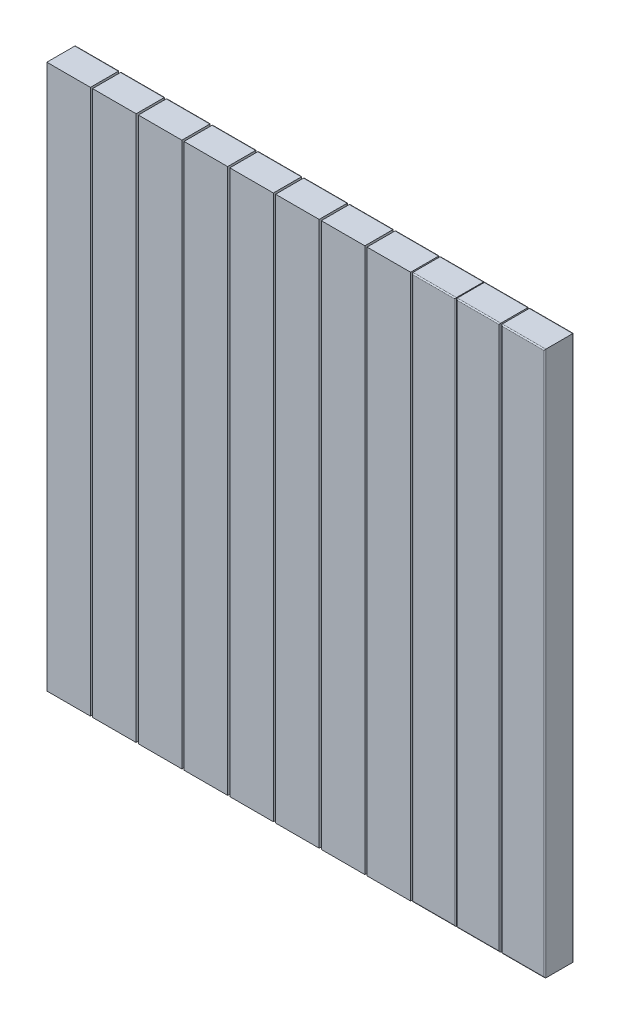
from build123d import *

# Parameters (mm, degrees)
SKETCH1_W              = 200
SKETCH1_H              = 2500
BOSS_EXTRUDE1_DEPTH    = 133
BOSS_EXTRUDE1_2_DEPTH  = 133
BOSS_EXTRUDE1_3_DEPTH  = 133
BOSS_EXTRUDE1_4_DEPTH  = 133
BOSS_EXTRUDE1_5_DEPTH  = 133
BOSS_EXTRUDE1_6_DEPTH  = 133
BOSS_EXTRUDE1_7_DEPTH  = 133
BOSS_EXTRUDE1_8_DEPTH  = 133
BOSS_EXTRUDE1_9_DEPTH  = 133
BOSS_EXTRUDE1_10_DEPTH = 133
BOSS_EXTRUDE1_11_DEPTH = 133
FILLET1_R              = 5
FILLET2_R              = 5
FILLET3_R              = 5
FILLET4_R              = 5
FILLET5_R              = 5
FILLET6_R              = 5
FILLET7_R              = 5
FILLET8_R              = 5
FILLET9_R              = 5
FILLET10_R             = 5
FILLET11_R             = 5
FILLET12_R             = 5
FILLET13_R             = 5
FILLET14_R             = 5


with BuildPart() as part:
    # Sketch1 → Boss-Extrude1 (new body)
    with BuildSketch(Plane.XY):
        with Locations((310, 1250)):
            Rectangle(SKETCH1_W, SKETCH1_H)
    extrude(amount=BOSS_EXTRUDE1_DEPTH)

    # Fillet8
    fillet8_edges = [part.edges().sort_by_distance(p)[0] for p in [
        (210, 1250, 0),
        (310, 2500, 0),
        (410, 1250, 0),
        (310, 0, 0),
    ]]
    fillet(fillet8_edges, radius=FILLET8_R)


with BuildPart() as body_2:
    # Sketch1 → Boss-Extrude1 2 (new body)
    with BuildSketch(Plane.XY):
        with Locations((100, 1250)):
            Rectangle(SKETCH1_W, SKETCH1_H)
    extrude(amount=BOSS_EXTRUDE1_2_DEPTH)

    # Fillet1
    fillet1_edges = [body_2.edges().sort_by_distance(p)[0] for p in [
        (100, 2500, 0),
        (200, 1250, 0),
        (100, 0, 0),
        (0, 1250, 0),
    ]]
    fillet(fillet1_edges, radius=FILLET1_R)


with BuildPart() as body_3:
    # Sketch1 → Boss-Extrude1 3 (new body)
    with BuildSketch(Plane.XY):
        with Locations((520, 1250)):
            Rectangle(SKETCH1_W, SKETCH1_H)
    extrude(amount=BOSS_EXTRUDE1_3_DEPTH)

    # Fillet7
    fillet7_edges = [body_3.edges().sort_by_distance(p)[0] for p in [
        (420, 1250, 0),
        (520, 2500, 0),
        (620, 1250, 0),
        (520, 0, 0),
    ]]
    fillet(fillet7_edges, radius=FILLET7_R)


with BuildPart() as body_4:
    # Sketch1 → Boss-Extrude1 4 (new body)
    with BuildSketch(Plane.XY):
        with Locations((730, 1250)):
            Rectangle(SKETCH1_W, SKETCH1_H)
    extrude(amount=BOSS_EXTRUDE1_4_DEPTH)

    # Fillet6
    fillet6_edges = [body_4.edges().sort_by_distance(p)[0] for p in [
        (630, 1250, 0),
        (730, 2500, 0),
        (830, 1250, 0),
        (730, 0, 0),
    ]]
    fillet(fillet6_edges, radius=FILLET6_R)


with BuildPart() as body_5:
    # Sketch1 → Boss-Extrude1 5 (new body)
    with BuildSketch(Plane.XY):
        with Locations((940, 1250)):
            Rectangle(SKETCH1_W, SKETCH1_H)
    extrude(amount=BOSS_EXTRUDE1_5_DEPTH)

    # Fillet5
    fillet5_edges = [body_5.edges().sort_by_distance(p)[0] for p in [
        (840, 1250, 0),
        (940, 2500, 0),
        (1040, 1250, 0),
        (940, 0, 0),
    ]]
    fillet(fillet5_edges, radius=FILLET5_R)


with BuildPart() as body_6:
    # Sketch1 → Boss-Extrude1 6 (new body)
    with BuildSketch(Plane.XY):
        with Locations((1150, 1250)):
            Rectangle(SKETCH1_W, SKETCH1_H)
    extrude(amount=BOSS_EXTRUDE1_6_DEPTH)

    # Fillet4
    fillet4_edges = [body_6.edges().sort_by_distance(p)[0] for p in [
        (1050, 1250, 0),
        (1150, 2500, 0),
        (1250, 1250, 0),
        (1150, 0, 0),
    ]]
    fillet(fillet4_edges, radius=FILLET4_R)


with BuildPart() as body_7:
    # Sketch1 → Boss-Extrude1 7 (new body)
    with BuildSketch(Plane.XY):
        with Locations((1360, 1250)):
            Rectangle(SKETCH1_W, SKETCH1_H)
    extrude(amount=BOSS_EXTRUDE1_7_DEPTH)

    # Fillet3
    fillet3_edges = [body_7.edges().sort_by_distance(p)[0] for p in [
        (1260, 1250, 0),
        (1360, 2500, 0),
        (1460, 1250, 0),
        (1360, 0, 0),
    ]]
    fillet(fillet3_edges, radius=FILLET3_R)


with BuildPart() as body_8:
    # Sketch1 → Boss-Extrude1 8 (new body)
    with BuildSketch(Plane.XY):
        with Locations((1570, 1250)):
            Rectangle(SKETCH1_W, SKETCH1_H)
    extrude(amount=BOSS_EXTRUDE1_8_DEPTH)

    # Fillet2
    fillet2_edges = [body_8.edges().sort_by_distance(p)[0] for p in [
        (1470, 1250, 0),
        (1570, 2500, 0),
        (1670, 1250, 0),
        (1570, 0, 0),
    ]]
    fillet(fillet2_edges, radius=FILLET2_R)


with BuildPart() as body_9:
    # Sketch1 → Boss-Extrude1 9 (new body)
    with BuildSketch(Plane.XY):
        with Locations((1775.997192349, 1250)):
            Rectangle(SKETCH1_W, SKETCH1_H)
    extrude(amount=BOSS_EXTRUDE1_9_DEPTH)

    # Fillet9
    fillet9_edges = [body_9.edges().sort_by_distance(p)[0] for p in [
        (1775.997192349, 2500, 133),
        (1675.997192349, 1250, 133),
        (1775.997192349, 0, 133),
        (1875.997192349, 1250, 133),
    ]]
    fillet(fillet9_edges, radius=FILLET9_R)

    # Fillet13
    fillet13_edges = [body_9.edges().sort_by_distance(p)[0] for p in [
        (1675.997192349, 1250, 0),
        (1775.997192349, 2500, 0),
        (1875.997192349, 1250, 0),
        (1775.997192349, 0, 0),
    ]]
    fillet(fillet13_edges, radius=FILLET13_R)


with BuildPart() as body_10:
    # Sketch1 → Boss-Extrude1 10 (new body)
    with BuildSketch(Plane.XY):
        with Locations((1979.782009001, 1250)):
            Rectangle(SKETCH1_W, SKETCH1_H)
    extrude(amount=BOSS_EXTRUDE1_10_DEPTH)

    # Fillet10
    fillet10_edges = [body_10.edges().sort_by_distance(p)[0] for p in [
        (1979.782009001, 2500, 133),
        (1879.782009001, 1250, 133),
        (1979.782009001, 0, 133),
        (2079.782009001, 1250, 133),
    ]]
    fillet(fillet10_edges, radius=FILLET10_R)

    # Fillet12
    fillet12_edges = [body_10.edges().sort_by_distance(p)[0] for p in [
        (1879.782009001, 1250, 0),
        (1979.782009001, 2500, 0),
        (2079.782009001, 1250, 0),
        (1979.782009001, 0, 0),
    ]]
    fillet(fillet12_edges, radius=FILLET12_R)


with BuildPart() as body_11:
    # Sketch1 → Boss-Extrude1 11 (new body)
    with BuildSketch(Plane.XY):
        with Locations((2186.146700922, 1250)):
            Rectangle(SKETCH1_W, SKETCH1_H)
    extrude(amount=BOSS_EXTRUDE1_11_DEPTH)

    # Fillet11
    fillet11_edges = [body_11.edges().sort_by_distance(p)[0] for p in [
        (2186.146700922, 2500, 133),
        (2086.146700922, 1250, 133),
        (2186.146700922, 0, 133),
        (2286.146700922, 1250, 133),
    ]]
    fillet(fillet11_edges, radius=FILLET11_R)

    # Fillet14
    fillet14_edges = [body_11.edges().sort_by_distance(p)[0] for p in [
        (2086.146700922, 1250, 0),
        (2186.146700922, 2500, 0),
        (2286.146700922, 1250, 0),
        (2186.146700922, 0, 0),
    ]]
    fillet(fillet14_edges, radius=FILLET14_R)


solid = Compound([part.part, body_2.part, body_3.part, body_4.part, body_5.part, body_6.part, body_7.part, body_8.part, body_9.part, body_10.part, body_11.part])
